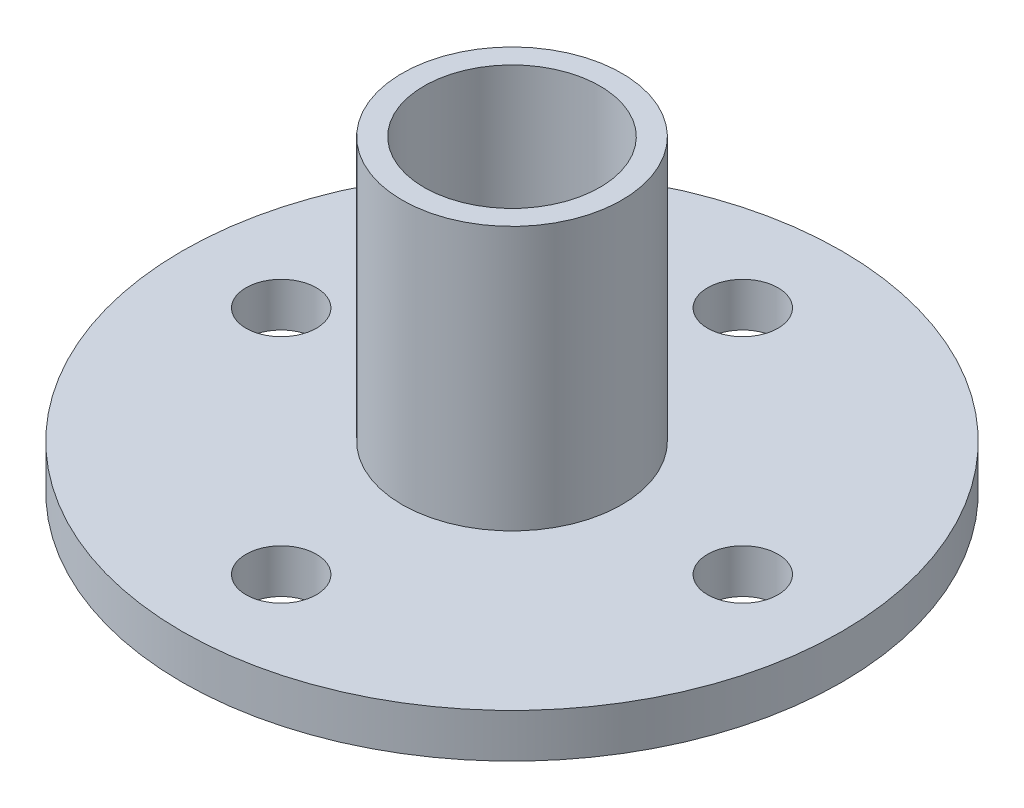
from build123d import *

# Parameters (mm, degrees)
SKETCH_1_R          = 15
EXTRUDE_1_DEPTH     = 2
SKETCH_2_R          = 5
SKETCH_2_R_2        = 4
EXTRUDE_2_DEPTH     = 12
CUT_EXTRUDE_START   = -12
SKETCH_3_R          = 4
CUT_EXTRUDE_1_DEPTH = 12
SKETCH_4_R          = 1.6
CUT_EXTRUDE_2_DEPTH = 12


with BuildPart() as part:
    # 草图1 → 凸台-拉伸1 (new body)
    with BuildSketch(Plane(origin=(0, 0, 0), x_dir=(1, 0, 0), z_dir=(0, 1, 0))):
        with Locations(Location((0, 0, 0), (0, 0, 270))):
            Circle(SKETCH_1_R)
    extrude(amount=EXTRUDE_1_DEPTH)

    # 草图2 → 凸台-拉伸2 (add)
    with BuildSketch(Plane(origin=(0, 2, 0), x_dir=(1, 0, 0), z_dir=(0, 1, 0))):
        with Locations(Location((0, 0, 0), (0, 0, 270))):
            Circle(SKETCH_2_R)
        with Locations(Location((0, 0, 0), (0, 0, 270))):
            Circle(SKETCH_2_R_2, mode=Mode.SUBTRACT)
    extrude(amount=EXTRUDE_2_DEPTH)

    # 草图3 → 切除-拉伸1 (cut)
    with BuildSketch(Plane(origin=(0, 2, 0), x_dir=(1, 0, 0), z_dir=(0, 1, 0)).offset(CUT_EXTRUDE_START)):
        with Locations(Location((0, 0, 0), (0, 0, 270))):
            Circle(SKETCH_3_R)
    extrude(amount=CUT_EXTRUDE_1_DEPTH, mode=Mode.SUBTRACT)

    # 草图4 → 切除-拉伸2 (cut)
    with BuildSketch(Plane(origin=(0, 2, 0), x_dir=(1, 0, 0), z_dir=(0, 1, 0))):
        with Locations(Location((0, 10.5, 0), (0, 0, 270))):
            Circle(SKETCH_4_R)
        with Locations(Location((10.5, 0, 0), (0, 0, 270))):
            Circle(SKETCH_4_R)
        with Locations(Location((0, -10.5, 0), (0, 0, 270))):
            Circle(SKETCH_4_R)
        with Locations(Location((-10.5, 0, 0), (0, 0, 270))):
            Circle(SKETCH_4_R)
    extrude(amount=-CUT_EXTRUDE_2_DEPTH, mode=Mode.SUBTRACT)


solid = part.part
